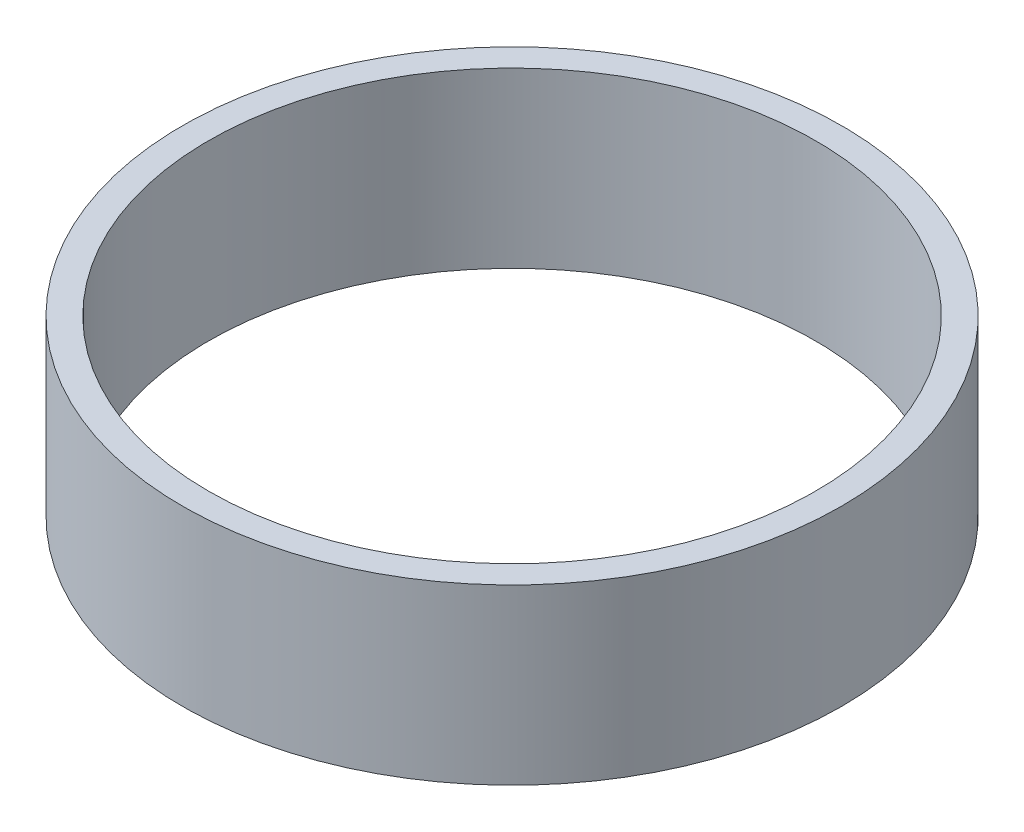
from build123d import *

# Parameters (mm, degrees)
SKETCH_1_R      = 38
SKETCH_1_R_2    = 35
EXTRUDE_1_DEPTH = 20


with BuildPart() as part:
    # 草图1 → 拉伸-薄壁1 (new body)
    with BuildSketch(Plane(origin=(0, 0, 0), x_dir=(1, 0, 0), z_dir=(0, 1, 0))):
        Circle(SKETCH_1_R)
        Circle(SKETCH_1_R_2, mode=Mode.SUBTRACT)
    extrude(amount=EXTRUDE_1_DEPTH)


solid = part.part
